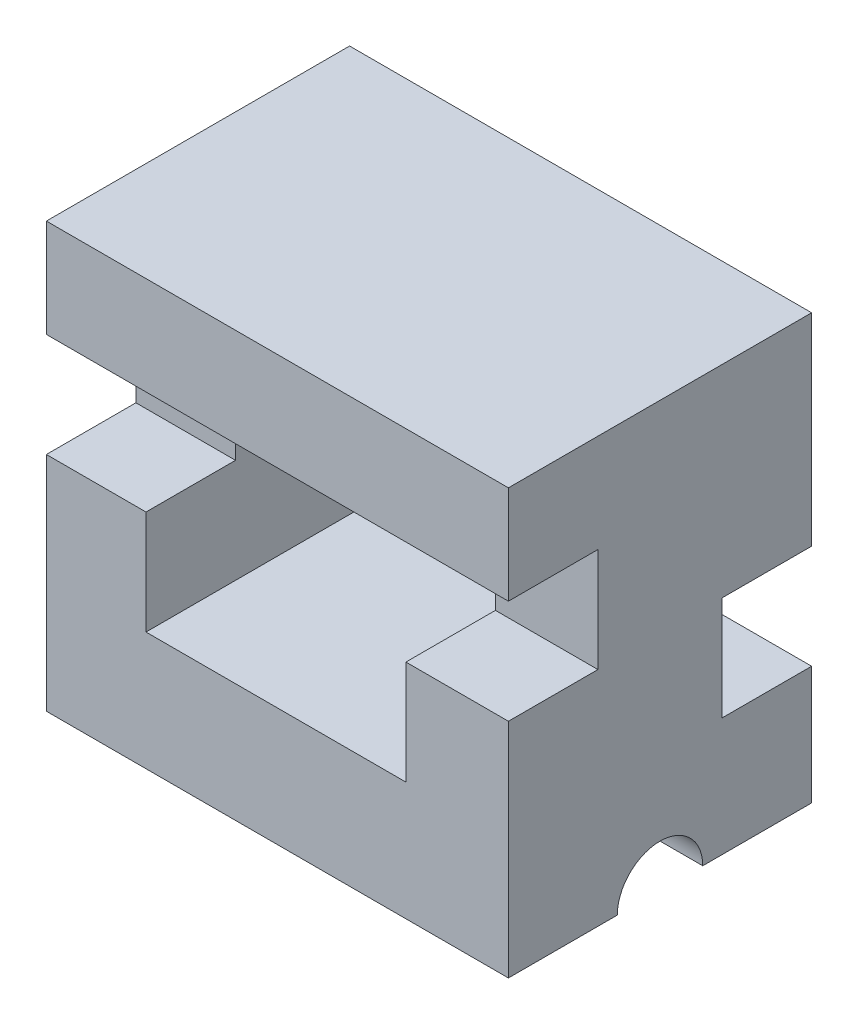
from build123d import *

# Parameters (mm, degrees)
SKETCH2_W             = 40.64
SKETCH2_H             = 26.67
BOSS_EXTRUDE1_DEPTH   = 37.338
SKETCH3_R             = 3.7592
BODY_TUBE_CUT_DEPTH   = 62.294573528
SKETCH4_W             = 22.86
SKETCH4_H             = 18.288
SERVO_BODY_HOLE_DEPTH = 26.67
CUT_EXTRUDE3_REACH    = 63.295
SKETCH5_W             = 7.874
SKETCH5_H             = 9.144


with BuildPart() as part:
    # Sketch2 → Boss-Extrude1 (new body)
    with BuildSketch(Plane(origin=(0, 0, 0), x_dir=(1, 0, 0), z_dir=(0, 1, 0))):
        with Locations((20.32, 13.335)):
            Rectangle(SKETCH2_W, SKETCH2_H)
    extrude(amount=BOSS_EXTRUDE1_DEPTH)

    # Sketch3 → Body Tube Cut (cut, through all)
    with BuildSketch(Plane(origin=(40.64, 0, 0), x_dir=(0, 0, -1), z_dir=(1, 0, 0))):
        with Locations((13.335, 0)):
            Circle(SKETCH3_R)
    extrude(amount=-BODY_TUBE_CUT_DEPTH, mode=Mode.SUBTRACT)

    # Sketch4 → Servo Body Hole (cut)
    with BuildSketch(Plane.XY):
        with Locations((20.193, 19.558)):
            Rectangle(SKETCH4_W, SKETCH4_H)
    extrude(amount=-SERVO_BODY_HOLE_DEPTH, mode=Mode.SUBTRACT)

    # Cut-Extrude3: up to this face of the body (flat: up to its plane)
    cut_extrude3_end = Plane(part.part.faces().sort_by_distance((0, 19.058270015, -13.335))[0])
    # Sketch5 → Cut-Extrude3 (cut, up to the picked face)
    with BuildSketch(Plane(origin=(40.64, 0, 0), x_dir=(0, 0, -1), z_dir=(1, 0, 0)), mode=Mode.PRIVATE) as cut_extrude3_sk1:
        with Locations((3.937, 24.13)):
            Rectangle(SKETCH5_W, SKETCH5_H)
    cut_extrude3_tool1 = split(extrude(cut_extrude3_sk1.sketch, amount=-CUT_EXTRUDE3_REACH, mode=Mode.PRIVATE), bisect_by=cut_extrude3_end, keep=Keep.BOTH, mode=Mode.PRIVATE)
    # Sketch5 → Cut-Extrude3 (cut, up to the picked face)
    with BuildSketch(Plane(origin=(40.64, 0, 0), x_dir=(0, 0, -1), z_dir=(1, 0, 0)), mode=Mode.PRIVATE) as cut_extrude3_sk2:
        with Locations((22.733, 14.986)):
            Rectangle(SKETCH5_W, SKETCH5_H)
    cut_extrude3_tool2 = split(extrude(cut_extrude3_sk2.sketch, amount=-CUT_EXTRUDE3_REACH, mode=Mode.PRIVATE), bisect_by=cut_extrude3_end, keep=Keep.BOTH, mode=Mode.PRIVATE)
    add(cut_extrude3_tool1.solids().sort_by(Axis((40.64, 24.13, -3.937), (-1, 0, 0)))[0], mode=Mode.SUBTRACT)
    add(cut_extrude3_tool2.solids().sort_by(Axis((40.64, 14.986, -22.733), (-1, 0, 0)))[0], mode=Mode.SUBTRACT)


solid = part.part
